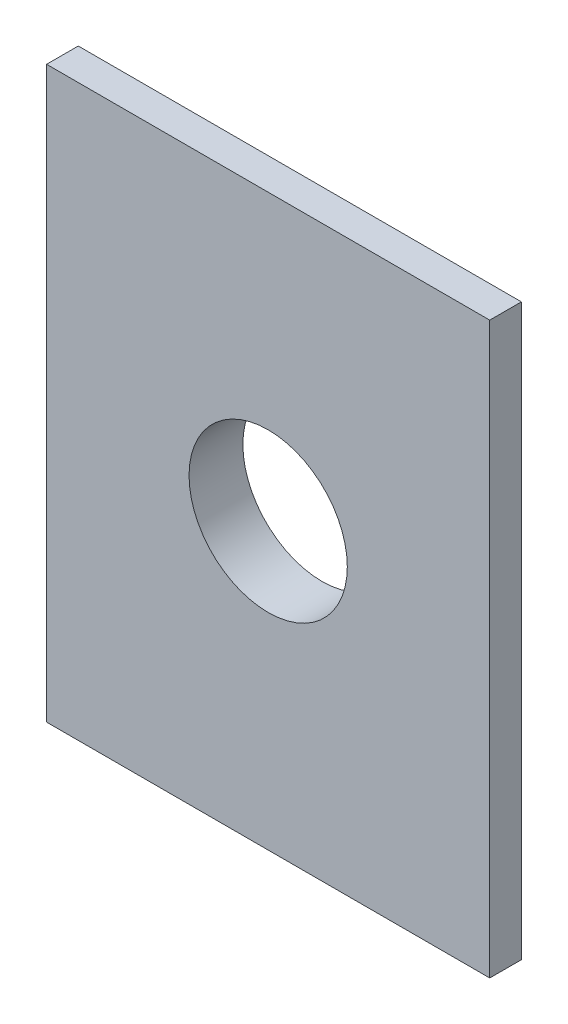
from build123d import *

# Parameters (mm, degrees)
CROQUIS1_R              = 35
SALIENTE_EXTRUIR1_DEPTH = 10
CROQUIS2_R              = 35
CROQUIS2_R_2            = 25
SALIENTE_EXTRUIR2_DEPTH = 7
SALIENTE_EXTRUIR4_START = -10
CROQUIS3_R              = 35
CROQUIS3_R_2            = 25
SALIENTE_EXTRUIR4_DEPTH = 10


with BuildPart() as part:
    # Croquis1 → Saliente-Extruir1 (new body)
    with BuildSketch(Plane.XY):
        Polygon((0, 0), (140, 0), (140, 180), (0, 180), (0, 49.177666069), align=None)
        with Locations((70, 90)):
            Circle(CROQUIS1_R, mode=Mode.SUBTRACT)
    extrude(amount=SALIENTE_EXTRUIR1_DEPTH)



with BuildPart() as body_2:
    # Croquis2 → Saliente-Extruir2 (new body)
    with BuildSketch(Plane(origin=(0, 0, 0), x_dir=(-1, 0, 0), z_dir=(0, 0, -1))):
        with Locations(Location((-70, 90, 0), (0, 0, 180))):
            Circle(CROQUIS2_R)
        with Locations((-70, 90)):
            Circle(CROQUIS2_R_2, mode=Mode.SUBTRACT)
    extrude(amount=SALIENTE_EXTRUIR2_DEPTH)


with BuildPart() as part_1:
    add(part.part)

    add(body_2.part)  # Saliente-Extruir4 merges body 2
    # Croquis3 → Saliente-Extruir4 (add)
    with BuildSketch(Plane.XY.offset(10).offset(SALIENTE_EXTRUIR4_START)):
        with Locations((70, 90)):
            Circle(CROQUIS3_R)
        with Locations((70, 90)):
            Circle(CROQUIS3_R_2, mode=Mode.SUBTRACT)
    extrude(amount=SALIENTE_EXTRUIR4_DEPTH)


solid = part_1.part
